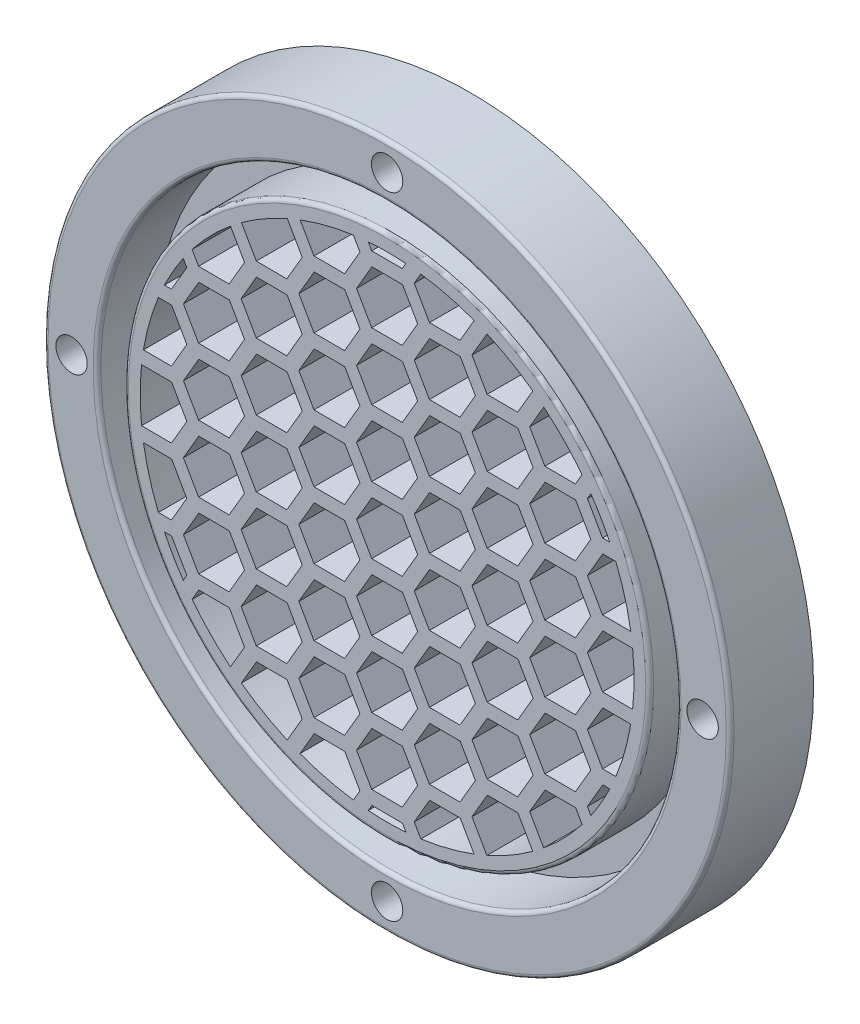
from build123d import *
from build123d.topology import SkipClean

# Parameters (mm, degrees)
IZIM1_R                     = 87.5
Y_KSEKLIK_EKSTR_ZYON1_DEPTH = 21.3
IZIM2_R                     = 74
IZIM2_R_2                   = 67
KES_EKSTR_ZYON1_DEPTH       = 15
IZIM3_R                     = 4
KES_EKSTR_ZYON2_DEPTH       = 15
IZIM4_R                     = 2
KES_EKSTR_ZYON3_DEPTH       = 100
KES_EKSTR_ZYON4_DEPTH       = 100
KES_EKSTR_ZYON5_DEPTH       = 19
IZIM7_R                     = 85.8
KES_EKSTR_ZYON7_DEPTH       = 6
RADYUS2_R                   = 1


with BuildPart() as part:
    # Çizim1 → Yükseklik-Ekstrüzyon1 (new body)
    with BuildSketch(Plane.XY):
        Circle(IZIM1_R)
    extrude(amount=Y_KSEKLIK_EKSTR_ZYON1_DEPTH)

    # Çizim2 → Kes-Ekstrüzyon1 (cut)
    with BuildSketch(Plane.XY.offset(21.3)):
        Circle(IZIM2_R)
        Circle(IZIM2_R_2, mode=Mode.SUBTRACT)
    extrude(amount=-KES_EKSTR_ZYON1_DEPTH, mode=Mode.SUBTRACT)

    # Çizim3 → Kes-Ekstrüzyon2 (cut)
    with BuildSketch(Plane.XY.offset(21.3)):
        with Locations((0, 80.5)):
            Circle(IZIM3_R)
        with Locations((80.5, 0)):
            Circle(IZIM3_R)
        with Locations((0, -80.5)):
            Circle(IZIM3_R)
        with Locations((-80.5, 0)):
            Circle(IZIM3_R)
    extrude(amount=-KES_EKSTR_ZYON2_DEPTH, mode=Mode.SUBTRACT)

    # Çizim4 → Kes-Ekstrüzyon3 (cut)
    with BuildSketch(Plane.XY.offset(21.3)):
        with Locations((0, 80.5)):
            Circle(IZIM4_R)
        with Locations((80.5, 0)):
            Circle(IZIM4_R)
        with Locations((0, -80.5)):
            Circle(IZIM4_R)
        with Locations((-80.5, 0)):
            Circle(IZIM4_R)
    extrude(amount=-KES_EKSTR_ZYON3_DEPTH, mode=Mode.SUBTRACT)

    # Çizim5 → Kes-Ekstrüzyon4 (cut)
    with BuildSketch(Plane.XY.offset(21.3)):
        Polygon((18.589452184, 1.73271444), (22.516583234, 8.465295054), (18.649562914, 15.232580614), (10.855411545, 15.26728556), (6.928280495, 8.534704946), (10.795300815, 1.767419386), align=None)
        Polygon((3.86702032, -6.76728556), (7.794151369, -0.034704946), (3.927131049, 6.732580614), (-3.86702032, 6.76728556), (-7.794151369, 0.034704946), (-3.927131049, -6.732580614), align=None)
        Polygon((10.795300815, -15.232580614), (18.589452184, -15.26728556), (22.516583234, -8.534704946), (18.649562914, -1.767419386), (10.855411545, -1.73271444), (6.928280495, -8.465295054), align=None)
        Polygon((-7.794151369, -16.965295054), (-3.927131049, -23.732580614), (3.86702032, -23.76728556), (7.794151369, -17.034704946), (3.927131049, -10.267419386), (-3.86702032, -10.23271444), align=None)
        Polygon((-18.589452184, -1.73271444), (-22.516583234, -8.465295054), (-18.649562914, -15.232580614), (-10.855411545, -15.26728556), (-6.928280495, -8.534704946), (-10.795300815, -1.767419386), align=None)
        Polygon((-10.795300815, 15.232580614), (-18.589452184, 15.26728556), (-22.516583234, 8.534704946), (-18.649562914, 1.767419386), (-10.855411545, 1.73271444), (-6.928280495, 8.465295054), align=None)
        Polygon((7.794151369, 16.965295054), (3.927131049, 23.732580614), (-3.86702032, 23.76728556), (-7.794151369, 17.034704946), (-3.927131049, 10.267419386), (3.86702032, 10.23271444), align=None)
        Polygon((33.311884049, 10.232714441), (37.239015098, 16.965295054), (33.371994779, 23.732580614), (25.577843409, 23.76728556), (21.65071236, 17.034704946), (25.51773268, 10.267419387), align=None)
        Polygon((48.034315914, 18.732714441), (51.961446963, 25.465295055), (48.094426643, 32.232580614), (40.300275274, 32.26728556), (36.373144225, 25.534704946), (40.240164544, 18.767419387), align=None)
        with BuildLine():
            Line((51.994210165, 35.575301957), (51.095576089, 34.034704947))
            Line((51.095576089, 34.034704947), (54.962596409, 27.267419387))
            Line((54.962596409, 27.267419387), (56.79730001, 27.259250019))
            ThreePointArc((56.79730001, 27.259250019), (54.55444392, 31.508929663), (51.994210165, 35.575301957))
        make_face()
        Polygon((18.589452184, 18.732714441), (22.516583234, 25.465295055), (18.649562914, 32.232580614), (10.855411545, 32.26728556), (6.928280495, 25.534704946), (10.795300815, 18.767419387), align=None)
        Polygon((-10.795300815, 32.232580614), (-18.589452184, 32.26728556), (-22.516583234, 25.534704946), (-18.649562914, 18.767419387), (-10.855411545, 18.732714441), (-6.928280495, 25.465295055), align=None)
        Polygon((7.794151369, 33.965295055), (3.927131049, 40.732580614), (-3.86702032, 40.76728556), (-7.794151369, 34.034704946), (-3.927131049, 27.267419387), (3.86702032, 27.232714441), align=None)
        Polygon((33.311884049, 27.232714441), (37.239015098, 33.965295055), (33.371994779, 40.732580614), (25.577843409, 40.76728556), (21.65071236, 34.034704947), (25.51773268, 27.267419387), align=None)
        with BuildLine():
            Line((48.034315914, 35.732714441), (49.74248483, 38.661158841))
            ThreePointArc((49.74248483, 38.661158841), (45.135317639, 43.952282098), (39.968400014, 48.698326463))
            Line((39.968400014, 48.698326463), (36.373144225, 42.534704947))
            Line((36.373144225, 42.534704947), (40.240164544, 35.767419387))
            Line((40.240164544, 35.767419387), (48.034315914, 35.732714441))
        make_face()
        Polygon((18.589452184, 35.732714441), (22.516583234, 42.465295055), (18.649562914, 49.232580615), (10.855411545, 49.267285561), (6.928280495, 42.534704947), (10.795300815, 35.767419387), align=None)
        Polygon((-10.795300815, 49.232580615), (-18.589452184, 49.267285561), (-22.516583234, 42.534704947), (-18.649562914, 35.767419387), (-10.855411545, 35.732714441), (-6.928280495, 42.465295055), align=None)
        Polygon((7.794151369, 50.965295055), (3.927131049, 57.732580615), (-3.86702032, 57.767285561), (-7.794151369, 51.034704947), (-3.927131049, 44.267419387), (3.86702032, 44.232714441), align=None)
        with BuildLine():
            Line((33.311884049, 44.232714442), (37.177944938, 50.860597816))
            ThreePointArc((37.177944938, 50.860597816), (31.514533885, 54.551206714), (25.488298213, 57.613771394))
            Line((25.488298213, 57.613771394), (21.65071236, 51.034704947))
            Line((21.65071236, 51.034704947), (25.51773268, 44.267419388))
            Line((25.51773268, 44.267419388), (33.311884049, 44.232714442))
        make_face()
        with BuildLine():
            Line((18.589452184, 52.732714442), (22.217415198, 58.952408449))
            ThreePointArc((22.217415198, 58.952408449), (15.507934548, 61.06147694), (8.605179864, 62.409541574))
            Line((8.605179864, 62.409541574), (6.928280495, 59.534704947))
            Line((6.928280495, 59.534704947), (10.795300815, 52.767419388))
            Line((10.795300815, 52.767419388), (18.589452184, 52.732714442))
        make_face()
        with BuildLine():
            Line((-22.189787831, 58.962812993), (-18.649562914, 52.767419388))
            Line((-18.649562914, 52.767419388), (-10.855411545, 52.732714442))
            Line((-10.855411545, 52.732714442), (-6.928280495, 59.465295056))
            Line((-6.928280495, 59.465295056), (-8.610303281, 62.408834931))
            ThreePointArc((-8.610303281, 62.408834931), (-15.496134032, 61.064472732), (-22.189787831, 58.962812993))
        make_face()
        with BuildLine():
            Line((-4.81201016, 62.815957831), (-3.927131049, 61.267419388))
            Line((-3.927131049, 61.267419388), (3.86702032, 61.232714442))
            Line((3.86702032, 61.232714442), (4.791447, 62.817529684))
            ThreePointArc((4.791447, 62.817529684), (-0.010311574, 62.999999156), (-4.81201016, 62.815957831))
        make_face()
        Polygon((-25.51773268, 23.732580614), (-33.311884049, 23.76728556), (-37.239015098, 17.034704946), (-33.371994779, 10.267419387), (-25.577843409, 10.232714441), (-21.65071236, 16.965295054), align=None)
        Polygon((-25.51773268, 40.732580614), (-33.311884049, 40.76728556), (-37.239015098, 34.034704947), (-33.371994779, 27.267419387), (-25.577843409, 27.232714441), (-21.65071236, 33.965295055), align=None)
        with BuildLine():
            Line((-37.150840528, 50.880399449), (-33.371994779, 44.267419388))
            Line((-33.371994779, 44.267419388), (-25.577843409, 44.232714442))
            Line((-25.577843409, 44.232714442), (-21.65071236, 50.965295055))
            Line((-21.65071236, 50.965295055), (-25.457597291, 57.627343685))
            ThreePointArc((-25.457597291, 57.627343685), (-31.485463879, 54.56799029), (-37.150840528, 50.880399449))
        make_face()
        Polygon((-33.311884049, 6.76728556), (-37.239015098, 0.034704946), (-33.371994779, -6.732580613), (-25.577843409, -6.767285559), (-21.65071236, -0.034704946), (-25.51773268, 6.732580614), align=None)
        Polygon((-40.240164544, 32.232580614), (-48.034315914, 32.26728556), (-51.961446963, 25.534704946), (-48.094426643, 18.767419387), (-40.300275274, 18.732714441), (-36.373144225, 25.465295055), align=None)
        with BuildLine():
            Line((-49.74565851, 38.657075154), (-48.094426643, 35.767419387))
            Line((-48.094426643, 35.767419387), (-40.300275274, 35.732714441))
            Line((-40.300275274, 35.732714441), (-36.373144225, 42.465295055))
            Line((-36.373144225, 42.465295055), (-39.945575732, 48.717050193))
            ThreePointArc((-39.945575732, 48.717050193), (-45.126822948, 43.961003749), (-49.74565851, 38.657075154))
        make_face()
        Polygon((-48.034315914, 15.26728556), (-51.961446963, 8.534704946), (-48.094426643, 1.767419387), (-40.300275274, 1.732714441), (-36.373144225, 8.465295055), (-40.240164544, 15.232580614), align=None)
        with BuildLine():
            Line((-56.806220325, 27.240655874), (-55.022707139, 27.232714441))
            Line((-55.022707139, 27.232714441), (-51.095576089, 33.965295055))
            Line((-51.095576089, 33.965295055), (-52.00585301, 35.558279665))
            ThreePointArc((-52.00585301, 35.558279665), (-54.564755495, 31.491069493), (-56.806220325, 27.240655874))
        make_face()
        with BuildLine():
            Line((-62.158187846, 10.26448653), (-55.022707139, 10.232714441))
            Line((-55.022707139, 10.232714441), (-51.095576089, 16.965295055))
            Line((-51.095576089, 16.965295055), (-54.962596409, 23.732580614))
            Line((-54.962596409, 23.732580614), (-58.352788111, 23.74767609))
            ThreePointArc((-58.352788111, 23.74767609), (-60.631451671, 17.112190634), (-62.158187846, 10.26448653))
        make_face()
        with BuildLine():
            Line((-62.639138741, -6.733371944), (-55.022707138, -6.767285559))
            Line((-55.022707138, -6.767285559), (-51.095576089, -0.034704945))
            Line((-51.095576089, -0.034704945), (-54.962596409, 6.732580614))
            Line((-54.962596409, 6.732580614), (-62.635542229, 6.766745869))
            ThreePointArc((-62.635542229, 6.766745869), (-62.999997764, 0.016783577), (-62.639138741, -6.733371944))
        make_face()
        Polygon((-48.034315913, -1.73271444), (-51.961446963, -8.465295054), (-48.094426643, -15.232580613), (-40.300275274, -15.267285559), (-36.373144224, -8.534704946), (-40.240164544, -1.767419386), align=None)
        Polygon((-33.311884048, -10.23271444), (-37.239015098, -16.965295054), (-33.371994778, -23.732580614), (-25.577843409, -23.76728556), (-21.650712359, -17.034704946), (-25.517732679, -10.267419386), align=None)
        Polygon((-22.516583234, -25.465295054), (-18.649562914, -32.232580614), (-10.855411545, -32.26728556), (-6.928280495, -25.534704946), (-10.795300815, -18.767419386), (-18.589452184, -18.73271444), align=None)
        with BuildLine():
            Line((-58.350838374, -23.75246642), (-55.022707138, -23.767285559))
            Line((-55.022707138, -23.767285559), (-51.095576089, -17.034704946))
            Line((-51.095576089, -17.034704946), (-54.962596408, -10.267419386))
            Line((-54.962596408, -10.267419386), (-62.16299093, -10.235358256))
            ThreePointArc((-62.16299093, -10.235358256), (-60.634757497, -17.10047319), (-58.350838374, -23.75246642))
        make_face()
        Polygon((-48.034315913, -18.73271444), (-51.961446962, -25.465295054), (-48.094426642, -32.232580614), (-40.300275273, -32.26728556), (-36.373144224, -25.534704946), (-40.240164544, -18.767419386), align=None)
        Polygon((-37.239015098, -33.965295054), (-33.371994778, -40.732580614), (-25.577843409, -40.76728556), (-21.650712359, -34.034704946), (-25.517732679, -27.267419386), (-33.311884048, -27.23271444), align=None)
        with BuildLine():
            Line((-51.994210164, -35.575301958), (-51.095576088, -34.034704946))
            Line((-51.095576088, -34.034704946), (-54.962596408, -27.267419386))
            Line((-54.962596408, -27.267419386), (-56.79730001, -27.259250018))
            ThreePointArc((-56.79730001, -27.259250018), (-54.55444392, -31.508929663), (-51.994210164, -35.575301958))
        make_face()
        with BuildLine():
            Line((-39.968400014, -48.698326463), (-36.373144224, -42.534704946))
            Line((-36.373144224, -42.534704946), (-40.240164544, -35.767419386))
            Line((-40.240164544, -35.767419386), (-48.034315913, -35.73271444))
            Line((-48.034315913, -35.73271444), (-49.74248483, -38.661158842))
            ThreePointArc((-49.74248483, -38.661158842), (-45.135317639, -43.952282098), (-39.968400014, -48.698326463))
        make_face()
        Polygon((25.517732679, -23.732580614), (33.311884048, -23.76728556), (37.239015098, -17.034704946), (33.371994778, -10.267419386), (25.577843409, -10.23271444), (21.650712359, -16.965295054), align=None)
        Polygon((48.034315913, 1.732714441), (51.961446963, 8.465295054), (48.094426643, 15.232580614), (40.300275274, 15.26728556), (36.373144224, 8.534704946), (40.240164544, 1.767419387), align=None)
        Polygon((33.311884048, -6.76728556), (37.239015098, -0.034704946), (33.371994778, 6.732580614), (25.577843409, 6.76728556), (21.650712359, 0.034704946), (25.517732679, -6.732580614), align=None)
        with BuildLine():
            Line((58.350838374, 23.752466421), (55.022707138, 23.76728556))
            Line((55.022707138, 23.76728556), (51.095576089, 17.034704946))
            Line((51.095576089, 17.034704946), (54.962596409, 10.267419387))
            Line((54.962596409, 10.267419387), (62.16299093, 10.235358256))
            ThreePointArc((62.16299093, 10.235358256), (60.634757496, 17.100473191), (58.350838374, 23.752466421))
        make_face()
        Polygon((6.928280495, -25.465295054), (10.795300815, -32.232580614), (18.589452184, -32.26728556), (22.516583234, -25.534704946), (18.649562914, -18.767419386), (10.855411544, -18.73271444), align=None)
        Polygon((-7.794151369, -33.965295054), (-3.927131049, -40.732580614), (3.86702032, -40.76728556), (7.794151369, -34.034704946), (3.927131049, -27.267419386), (-3.86702032, -27.23271444), align=None)
        Polygon((-22.516583234, -42.465295054), (-18.649562914, -49.232580614), (-10.855411545, -49.26728556), (-6.928280495, -42.534704946), (-10.795300815, -35.767419386), (-18.589452184, -35.73271444), align=None)
        Polygon((40.240164543, -32.232580614), (48.034315913, -32.26728556), (51.961446962, -25.534704946), (48.094426642, -18.767419386), (40.300275273, -18.73271444), (36.373144224, -25.465295054), align=None)
        with BuildLine():
            Line((62.639138741, 6.733371945), (55.022707138, 6.76728556))
            Line((55.022707138, 6.76728556), (51.095576088, 0.034704946))
            Line((51.095576088, 0.034704946), (54.962596408, -6.732580613))
            Line((54.962596408, -6.732580613), (62.635542229, -6.766745869))
            ThreePointArc((62.635542229, -6.766745869), (62.999997764, -0.016783576), (62.639138741, 6.733371945))
        make_face()
        Polygon((48.034315913, -15.26728556), (51.961446962, -8.534704946), (48.094426642, -1.767419386), (40.300275273, -1.73271444), (36.373144224, -8.465295054), (40.240164543, -15.232580614), align=None)
        Polygon((21.650712359, -33.965295054), (25.517732679, -40.732580614), (33.311884048, -40.76728556), (37.239015098, -34.034704946), (33.371994778, -27.267419386), (25.577843409, -27.23271444), align=None)
        Polygon((6.928280495, -42.465295054), (10.795300815, -49.232580614), (18.589452184, -49.26728556), (22.516583233, -42.534704946), (18.649562914, -35.767419386), (10.855411544, -35.73271444), align=None)
        Polygon((-7.794151369, -50.965295054), (-3.92713105, -57.732580614), (3.86702032, -57.76728556), (7.794151369, -51.034704946), (3.927131049, -44.267419386), (-3.86702032, -44.23271444), align=None)
        with BuildLine():
            Line((56.806220325, -27.240655873), (55.022707137, -27.23271444))
            Line((55.022707137, -27.23271444), (51.095576088, -33.965295054))
            Line((51.095576088, -33.965295054), (52.005853009, -35.558279666))
            ThreePointArc((52.005853009, -35.558279666), (54.564755495, -31.491069493), (56.806220325, -27.240655873))
        make_face()
        with BuildLine():
            Line((62.158187846, -10.264486529), (55.022707137, -10.23271444))
            Line((55.022707137, -10.23271444), (51.095576088, -16.965295054))
            Line((51.095576088, -16.965295054), (54.962596408, -23.732580614))
            Line((54.962596408, -23.732580614), (58.352788111, -23.747676089))
            ThreePointArc((58.352788111, -23.747676089), (60.631451671, -17.112190634), (62.158187846, -10.264486529))
        make_face()
        with BuildLine():
            Line((36.373144224, -42.465295054), (39.945575731, -48.717050193))
            ThreePointArc((39.945575731, -48.717050193), (45.126822948, -43.961003749), (49.74565851, -38.657075154))
            Line((49.74565851, -38.657075154), (48.094426642, -35.767419386))
            Line((48.094426642, -35.767419386), (40.300275273, -35.73271444))
            Line((40.300275273, -35.73271444), (36.373144224, -42.465295054))
        make_face()
        with BuildLine():
            Line((21.650712359, -50.965295054), (25.457597291, -57.627343685))
            ThreePointArc((25.457597291, -57.627343685), (31.485463879, -54.56799029), (37.150840528, -50.880399449))
            Line((37.150840528, -50.880399449), (33.371994778, -44.267419386))
            Line((33.371994778, -44.267419386), (25.577843409, -44.23271444))
            Line((25.577843409, -44.23271444), (21.650712359, -50.965295054))
        make_face()
        with BuildLine():
            Line((6.928280495, -59.465295054), (8.610303282, -62.408834931))
            ThreePointArc((8.610303282, -62.408834931), (15.496134032, -61.064472732), (22.189787832, -58.962812993))
            Line((22.189787832, -58.962812993), (18.649562914, -52.767419386))
            Line((18.649562914, -52.767419386), (10.855411544, -52.73271444))
            Line((10.855411544, -52.73271444), (6.928280495, -59.465295054))
        make_face()
        with BuildLine():
            Line((-25.488298213, -57.613771394), (-21.650712359, -51.034704946))
            Line((-21.650712359, -51.034704946), (-25.517732679, -44.267419386))
            Line((-25.517732679, -44.267419386), (-33.311884049, -44.23271444))
            Line((-33.311884049, -44.23271444), (-37.177944938, -50.860597816))
            ThreePointArc((-37.177944938, -50.860597816), (-31.514533885, -54.551206714), (-25.488298213, -57.613771394))
        make_face()
        with BuildLine():
            Line((-8.605179864, -62.409541574), (-6.928280495, -59.534704946))
            Line((-6.928280495, -59.534704946), (-10.795300815, -52.767419386))
            Line((-10.795300815, -52.767419386), (-18.589452184, -52.73271444))
            Line((-18.589452184, -52.73271444), (-22.217415199, -58.952408449))
            ThreePointArc((-22.217415199, -58.952408449), (-15.507934549, -61.061476939), (-8.605179864, -62.409541574))
        make_face()
        with BuildLine():
            Line((4.812010161, -62.815957831), (3.927131049, -61.267419386))
            Line((3.927131049, -61.267419386), (-3.86702032, -61.23271444))
            Line((-3.86702032, -61.23271444), (-4.791447001, -62.817529684))
            ThreePointArc((-4.791447001, -62.817529684), (0.010311574, -62.999999156), (4.812010161, -62.815957831))
        make_face()
    extrude(amount=-KES_EKSTR_ZYON4_DEPTH, mode=Mode.SUBTRACT)

    # Çizim6 → Kes-Ekstrüzyon5 (cut)
    with BuildSketch(Plane(origin=(0, 0, 0), x_dir=(-1, 0, 0), z_dir=(0, 0, -1))):
        with BuildLine():
            ThreePointArc((-2.903165309, 85.750869565), (-60.669761826, 60.669761826), (-85.750869565, 2.903165309))
            ThreePointArc((-85.750869565, 2.903165309), (-80.495050482, 5.999997959), (-75.244347826, 2.894498269))
            ThreePointArc((-75.244347826, 2.894498269), (-53.245140623, 53.245140623), (-2.894498269, 75.244347826))
            ThreePointArc((-2.894498269, 75.244347826), (-5.999997959, 80.495050482), (-2.903165309, 85.750869565))
        make_face()
        with BuildLine():
            ThreePointArc((75.244347826, -2.894498269), (80.495050482, -5.999997959), (85.750869565, -2.903165309))
            ThreePointArc((85.750869565, -2.903165309), (60.669761826, -60.669761826), (2.903165309, -85.750869565))
            ThreePointArc((2.903165309, -85.750869565), (5.999997959, -80.495050482), (2.894498269, -75.244347826))
            ThreePointArc((2.894498269, -75.244347826), (53.245140623, -53.245140623), (75.244347826, -2.894498269))
        make_face()
        with BuildLine():
            ThreePointArc((-2.894498269, -75.244347826), (-5.999997959, -80.495050482), (-2.903165309, -85.750869565))
            ThreePointArc((-2.903165309, -85.750869565), (-60.669761826, -60.669761826), (-85.750869565, -2.903165309))
            ThreePointArc((-85.750869565, -2.903165309), (-80.495050482, -5.999997959), (-75.244347826, -2.894498269))
            ThreePointArc((-75.244347826, -2.894498269), (-53.245140623, -53.245140623), (-2.894498269, -75.244347826))
        make_face()
        with BuildLine():
            ThreePointArc((2.894498269, 75.244347826), (5.999997959, 80.495050482), (2.903165309, 85.750869565))
            ThreePointArc((2.903165309, 85.750869565), (60.669761826, 60.669761826), (85.750869565, 2.903165309))
            ThreePointArc((85.750869565, 2.903165309), (80.495050482, 5.999997959), (75.244347826, 2.894498269))
            ThreePointArc((75.244347826, 2.894498269), (53.245140623, 53.245140623), (2.894498269, 75.244347826))
        make_face()
    extrude(amount=-KES_EKSTR_ZYON5_DEPTH, mode=Mode.SUBTRACT)

    # Çizim7 → Kes-Ekstrüzyon7 (cut)
    with SkipClean():  # the faces are left unmerged after this step: merging them gives an invalid solid
        with BuildSketch(Plane(origin=(0, 0, 0), x_dir=(-1, 0, 0), z_dir=(0, 0, -1))):
            Circle(IZIM7_R)
        extrude(amount=-KES_EKSTR_ZYON7_DEPTH, mode=Mode.SUBTRACT)

    # Radyus2
    radyus2_edges = [part.edges().sort_by_distance(p)[0] for p in [
        (-87.5, 0, 21.3),
        (-74, 0, 21.3),
        (-67, 0, 21.3),
    ]]
    fillet(radyus2_edges, radius=RADYUS2_R)


solid = part.part
